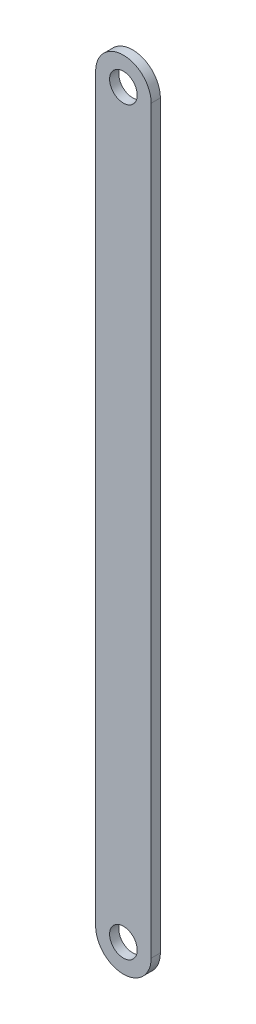
from build123d import *

# Parameters (mm, degrees)
SKETCH_1_R      = 3
EXTRUDE_1_DEPTH = 2


with BuildPart() as part:
    # 草图1 → 凸台-拉伸1 (new body)
    with BuildSketch(Plane.XY):
        with BuildLine():
            Line((6.038635547, 0), (6.038635547, -161))
            ThreePointArc((6.038635547, -161), (0, -167.038635547), (-6.038635547, -161))
            Line((-6.038635547, -161), (-6.038635547, 0))
            ThreePointArc((-6.038635547, 0), (0, 6.038635547), (6.038635547, 0))
        make_face()
        Circle(SKETCH_1_R, mode=Mode.SUBTRACT)
        with Locations((0, -161)):
            Circle(SKETCH_1_R, mode=Mode.SUBTRACT)
    extrude(amount=EXTRUDE_1_DEPTH)


solid = part.part
